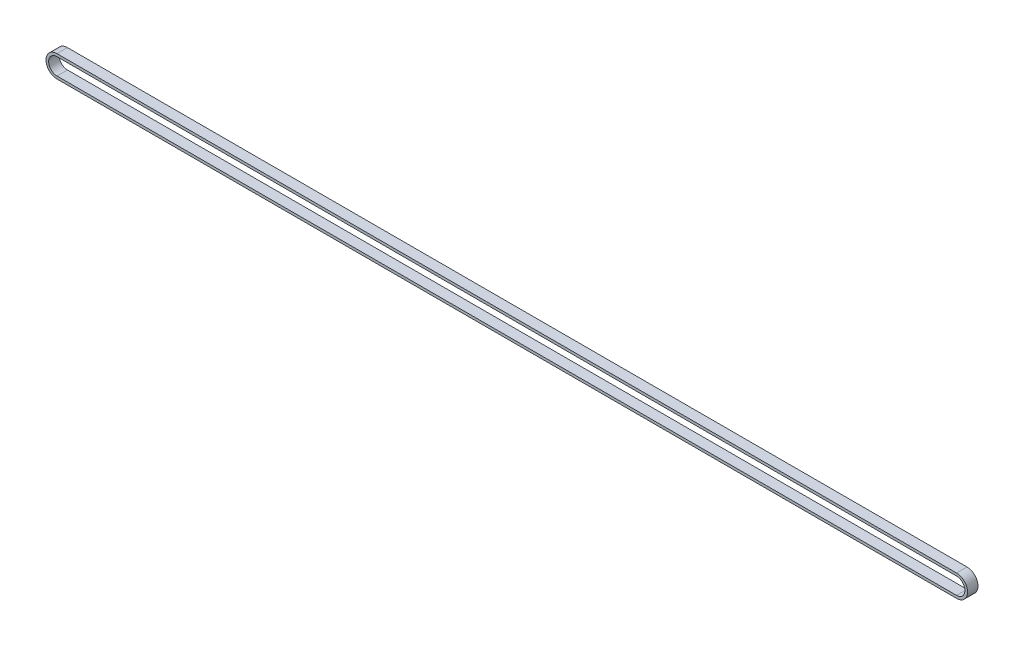
from build123d import *

# Parameters (mm, degrees)
BOSS_EXTRUDE1_DEPTH = 6


with BuildPart() as part:
    # Sketch1 → Boss-Extrude1 (new body)
    with BuildSketch(Plane.XY):
        with BuildLine():
            Line((-257.75, 0.235714286), (257.75, 0.235714286))
            ThreePointArc((257.75, 0.235714286), (264.05, -6.064285714), (257.75, -12.364285714))
            Line((257.75, -12.364285714), (-257.75, -12.364285714))
            ThreePointArc((-257.75, -12.364285714), (-264.05, -6.064285714), (-257.75, 0.235714286))
        make_face()
        with BuildLine():
            Line((-257.75, -10.864285714), (257.75, -10.864285714))
            ThreePointArc((257.75, -10.864285714), (262.55, -6.064285714), (257.75, -1.264285714))
            Line((257.75, -1.264285714), (-257.75, -1.264285714))
            ThreePointArc((-257.75, -1.264285714), (-262.55, -6.064285714), (-257.75, -10.864285714))
        make_face(mode=Mode.SUBTRACT)
    extrude(amount=BOSS_EXTRUDE1_DEPTH)


solid = part.part
